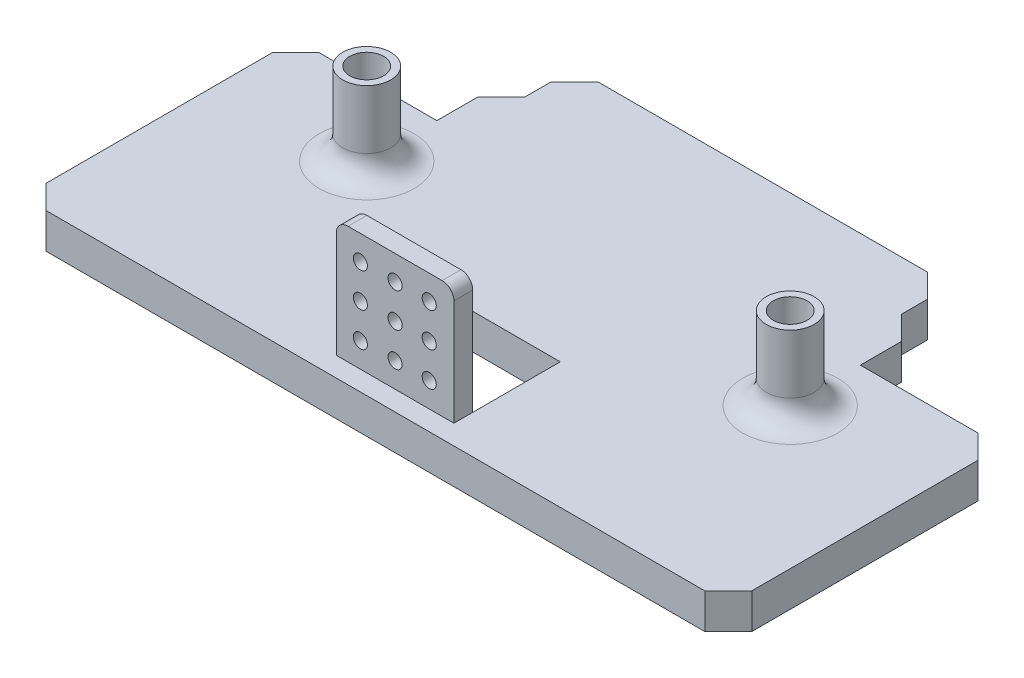
from build123d import *

# Parameters (mm, degrees)
SKETCH1_W           = 150
SKETCH1_H           = 57.32
BOSS_EXTRUDE1_DEPTH = 7.5
SKETCH2_R           = 5.1
BOSS_EXTRUDE2_DEPTH = 17.5
FILLET1_R           = 5
SKETCH3_R           = 3.6
CUT_EXTRUDE1_DEPTH  = 25
SKETCH4_W           = 30
SKETCH4_H           = 7.5
CUT_EXTRUDE2_DEPTH  = 13.75
CHAMFER1_SIZE       = 5
SKETCH5_W           = 80
SKETCH5_H           = 7.5
BOSS_EXTRUDE3_DEPTH = 10.5
CHAMFER2_SIZE       = 5
SKETCH6_R           = 1.5
CUT_EXTRUDE3_DEPTH  = 7.5
SKETCH11_W          = 150
SKETCH11_H          = 7.5
BOSS_EXTRUDE5_DEPTH = 14.5
CHAMFER3_SIZE       = 5
SKETCH12_W          = 25
SKETCH12_H          = 4
BOSS_EXTRUDE6_DEPTH = 25
SKETCH13_W          = 25
SKETCH13_H          = 18.6
CUT_EXTRUDE4_DEPTH  = 7.5
SKETCH14_R          = 1.5
CUT_EXTRUDE5_DEPTH  = 4
FILLET2_R           = 2.5


with BuildPart() as part:
    # Sketch1 → Boss-Extrude1 (new body)
    with BuildSketch(Plane(origin=(0, 0, 0), x_dir=(1, 0, 0), z_dir=(0, 1, 0))):
        Rectangle(SKETCH1_W, SKETCH1_H)
    extrude(amount=BOSS_EXTRUDE1_DEPTH)

    # Sketch2 → Boss-Extrude2 (add)
    with BuildSketch(Plane(origin=(0, 7.5, 0), x_dir=(1, 0, 0), z_dir=(0, 1, 0))):
        with Locations(Location((-45, 0, 0), (0, 0, 270))):
            Circle(SKETCH2_R)
        with Locations(Location((45, 0, 0), (0, 0, 270))):
            Circle(SKETCH2_R)
    extrude(amount=BOSS_EXTRUDE2_DEPTH)

    # Fillet1
    fillet1_edges = [part.edges().sort_by_distance(p)[0] for p in [
        (-45, 7.5, -5.1),
        (45, 7.5, -5.1),
    ]]
    fillet(fillet1_edges, radius=FILLET1_R)

    # Sketch3 → Cut-Extrude1 (cut)
    with BuildSketch(Plane(origin=(0, 25, 0), x_dir=(1, 0, 0), z_dir=(0, 1, 0))):
        with Locations(Location((-45, 0, 0), (0, 0, 270))):
            Circle(SKETCH3_R)
        with Locations(Location((45, 0, 0), (0, 0, 270))):
            Circle(SKETCH3_R)
    extrude(amount=-CUT_EXTRUDE1_DEPTH, mode=Mode.SUBTRACT)

    # Sketch4 → Cut-Extrude2 (cut)
    with BuildSketch(Plane(origin=(0, 0, -28.66), x_dir=(-1, 0, 0), z_dir=(0, 0, -1))):
        with Locations((-60, 3.75)):
            Rectangle(SKETCH4_W, SKETCH4_H)
        with Locations((60, 3.75)):
            Rectangle(SKETCH4_W, SKETCH4_H)
    extrude(amount=-CUT_EXTRUDE2_DEPTH, mode=Mode.SUBTRACT)

    # Chamfer1
    chamfer1_edges = [part.edges().sort_by_distance(p)[0] for p in [
        (75, 3.75, -14.91),
        (45, 3.75, -28.66),
        (-75, 3.75, -14.91),
        (-45, 3.75, -28.66),
    ]]
    chamfer(chamfer1_edges, length=CHAMFER1_SIZE)

    # Sketch5 → Boss-Extrude3 (add)
    with BuildSketch(Plane(origin=(0, 0, -28.66), x_dir=(-1, 0, 0), z_dir=(0, 0, -1))):
        with Locations((0, 3.75)):
            Rectangle(SKETCH5_W, SKETCH5_H)
    extrude(amount=BOSS_EXTRUDE3_DEPTH)

    # Chamfer2
    chamfer2_edges = [part.edges().sort_by_distance(p)[0] for p in [
        (40, 3.75, -39.16),
        (-40, 3.75, -39.16),
    ]]
    chamfer(chamfer2_edges, length=CHAMFER2_SIZE)

    # Sketch6 → Cut-Extrude3 (cut)
    with BuildSketch(Plane(origin=(0, 0, -39.16), x_dir=(-1, 0, 0), z_dir=(0, 0, -1))):
        with Locations((-15, 3.75)):
            Circle(SKETCH6_R)
        with Locations((15, 3.75)):
            Circle(SKETCH6_R)
    extrude(amount=-CUT_EXTRUDE3_DEPTH, mode=Mode.SUBTRACT)

    # Sketch11 → Boss-Extrude5 (add)
    with BuildSketch(Plane.XY.offset(28.66)):
        with Locations((0, 3.75)):
            Rectangle(SKETCH11_W, SKETCH11_H)
    extrude(amount=BOSS_EXTRUDE5_DEPTH)

    # Chamfer3
    chamfer3_edges = [part.edges().sort_by_distance(p)[0] for p in [
        (-75, 3.75, 43.16),
        (75, 3.75, 43.16),
    ]]
    chamfer(chamfer3_edges, length=CHAMFER3_SIZE)

    # Sketch12 → Boss-Extrude6 (add)
    with BuildSketch(Plane(origin=(0, 7.5, 0), x_dir=(1, 0, 0), z_dir=(0, 1, 0))):
        with Locations((0, -36.97)):
            Rectangle(SKETCH12_W, SKETCH12_H)
    extrude(amount=BOSS_EXTRUDE6_DEPTH)

    # Sketch13 → Cut-Extrude4 (cut)
    with BuildSketch(Plane(origin=(0, 7.5, 0), x_dir=(1, 0, 0), z_dir=(0, 1, 0))):
        with Locations((0, -25.67)):
            Rectangle(SKETCH13_W, SKETCH13_H)
    extrude(amount=-CUT_EXTRUDE4_DEPTH, mode=Mode.SUBTRACT)

    # Sketch14 → Cut-Extrude5 (cut)
    with BuildSketch(Plane(origin=(0, 0, 34.97), x_dir=(-1, 0, 0), z_dir=(0, 0, -1))):
        with Locations((7.375, 20)):
            Circle(SKETCH14_R)
        with Locations((7.375, 27.25)):
            Circle(SKETCH14_R)
        with Locations((7.375, 12.75)):
            Circle(SKETCH14_R)
        with Locations((-7.25, 27.25)):
            Circle(SKETCH14_R)
        with Locations((0, 27.25)):
            Circle(SKETCH14_R)
        with Locations((0, 20)):
            Circle(SKETCH14_R)
        with Locations((0, 12.75)):
            Circle(SKETCH14_R)
        with Locations((-7.25, 12.75)):
            Circle(SKETCH14_R)
        with Locations((-7.25, 20)):
            Circle(SKETCH14_R)
    extrude(amount=-CUT_EXTRUDE5_DEPTH, mode=Mode.SUBTRACT)

    # Fillet2
    fillet2_edges = [part.edges().sort_by_distance(p)[0] for p in [
        (-12.5, 32.5, 36.97),
        (12.5, 32.5, 36.97),
    ]]
    fillet(fillet2_edges, radius=FILLET2_R)


solid = part.part
